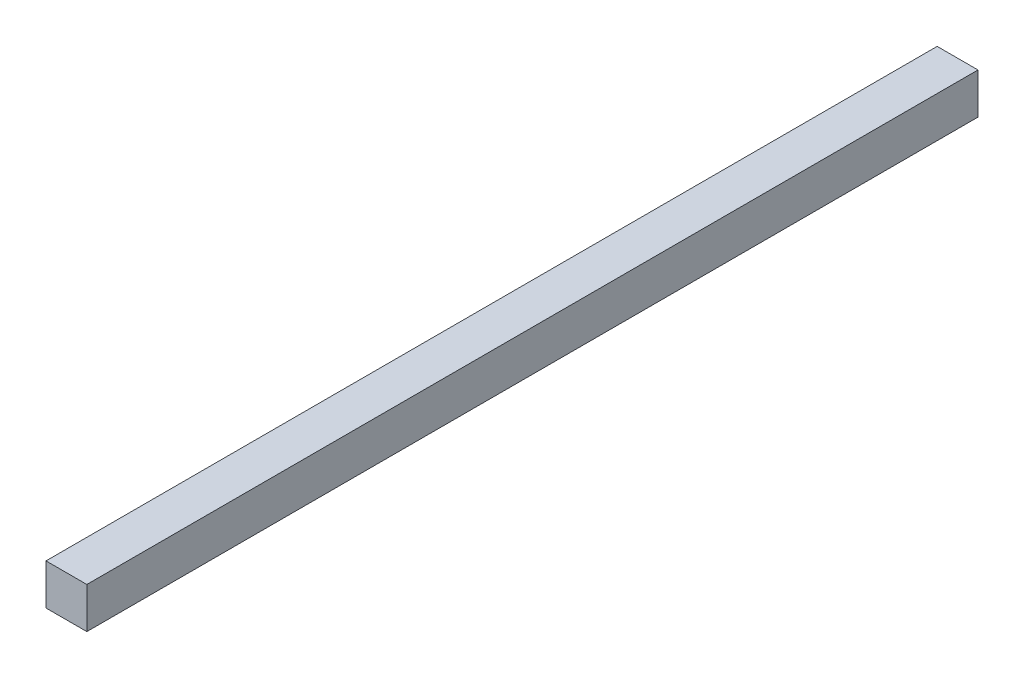
from build123d import *

# Parameters (mm, degrees)
SKETCH3_W           = 34.925
SKETCH3_H           = 34.925
BOSS_EXTRUDE1_DEPTH = 762


with BuildPart() as part:
    # Sketch3 → Boss-Extrude1 (new body)
    with BuildSketch(Plane.XY):
        Rectangle(SKETCH3_W, SKETCH3_H)
    extrude(amount=BOSS_EXTRUDE1_DEPTH)


solid = part.part
